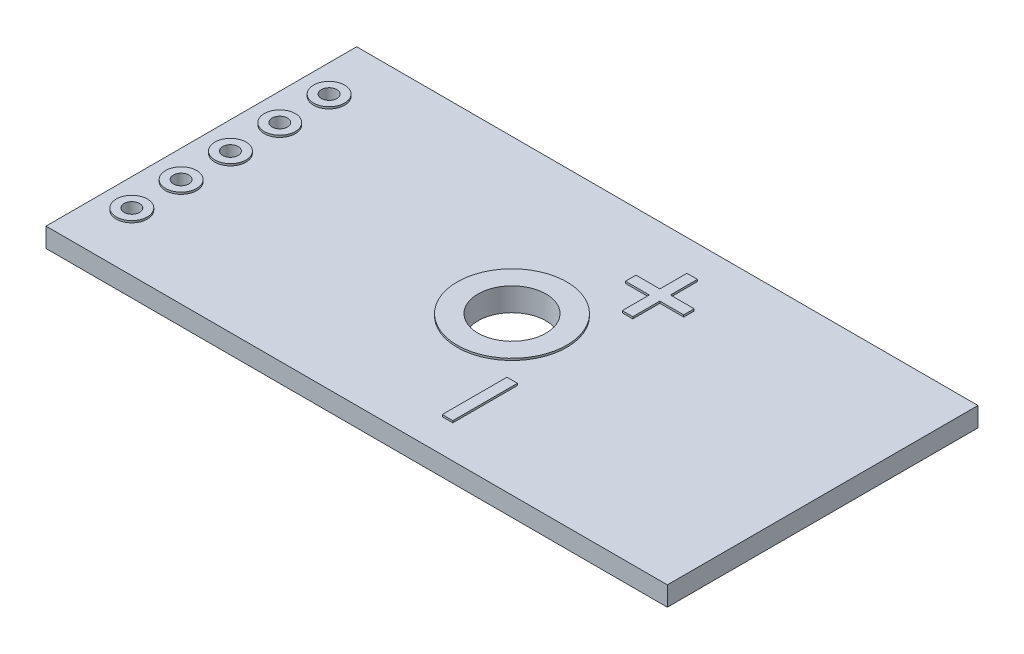
from build123d import *

# Parameters (mm, degrees)
SKETCH1_W                = 32
SKETCH1_H                = 16
BOSS_EXTRUDE1_DEPTH      = 1
SKETCH2_R                = 1.75
SKETCH2_R_2              = 0.4
CUT_EXTRUDE1_DEPTH       = 1
BOSS_EXTRUDE2_DEPTH      = 0.1
BOSS_EXTRUDE2_DEPTH_BACK = 1.1
SKETCH3_R                = 0.8
SKETCH3_R_2              = 0.4
SKETCH3_R_3              = 2.823446158
SKETCH3_R_4              = 1.75
SKETCH4_W                = 0.541769891
SKETCH4_H                = 3.328015046
BOSS_EXTRUDE3_DEPTH      = 0.1


with BuildPart() as part:
    # Sketch1 → Boss-Extrude1 (new body)
    with BuildSketch(Plane(origin=(0, 0, 0), x_dir=(1, 0, 0), z_dir=(0, 1, 0))):
        Rectangle(SKETCH1_W, SKETCH1_H)
    extrude(amount=BOSS_EXTRUDE1_DEPTH)

    # Sketch2 → Cut-Extrude1 (cut)
    with BuildSketch(Plane(origin=(0, 1, 0), x_dir=(1, 0, 0), z_dir=(0, 1, 0))):
        with Locations(Location((0, 0, 0), (0, 0, 270))):
            Circle(SKETCH2_R)
        with Locations(Location((-14.5, -5.08, 0), (0, 0, 270))):
            Circle(SKETCH2_R_2)
        with Locations(Location((-14.5, -2.54, 0), (0, 0, 270))):
            Circle(SKETCH2_R_2)
        with Locations(Location((-14.5, 0, 0), (0, 0, 270))):
            Circle(SKETCH2_R_2)
        with Locations(Location((-14.5, 2.54, 0), (0, 0, 270))):
            Circle(SKETCH2_R_2)
        with Locations(Location((-14.5, 5.08, 0), (0, 0, 270))):
            Circle(SKETCH2_R_2)
    extrude(amount=-CUT_EXTRUDE1_DEPTH, mode=Mode.SUBTRACT)

    # Sketch3 → Boss-Extrude2 (add, two sides: drawn at the far end of the back side and taken through both)
    # profile 1 of 6: a face of its own
    with BuildSketch(Plane(origin=(0, 1, 0), x_dir=(1, 0, 0), z_dir=(0, 1, 0)).offset(-BOSS_EXTRUDE2_DEPTH_BACK)):
        with Locations(Location((-14.5, 5.08, 0), (0, 0, 270))):
            Circle(SKETCH3_R)
        with Locations(Location((-14.5, 5.08, 0), (0, 0, 270))):
            Circle(SKETCH3_R_2, mode=Mode.SUBTRACT)
    # profile 2 of 6: a face of its own
    with BuildSketch(Plane(origin=(0, 1, 0), x_dir=(1, 0, 0), z_dir=(0, 1, 0)).offset(-BOSS_EXTRUDE2_DEPTH_BACK)):
        with Locations(Location((-14.5, 2.54, 0), (0, 0, 270))):
            Circle(SKETCH3_R)
        with Locations(Location((-14.5, 2.54, 0), (0, 0, 270))):
            Circle(SKETCH3_R_2, mode=Mode.SUBTRACT)
    # profile 3 of 6: a face of its own
    with BuildSketch(Plane(origin=(0, 1, 0), x_dir=(1, 0, 0), z_dir=(0, 1, 0)).offset(-BOSS_EXTRUDE2_DEPTH_BACK)):
        with Locations(Location((-14.5, 0, 0), (0, 0, 270))):
            Circle(SKETCH3_R)
        with Locations(Location((-14.5, 0, 0), (0, 0, 270))):
            Circle(SKETCH3_R_2, mode=Mode.SUBTRACT)
    # profile 4 of 6: a face of its own
    with BuildSketch(Plane(origin=(0, 1, 0), x_dir=(1, 0, 0), z_dir=(0, 1, 0)).offset(-BOSS_EXTRUDE2_DEPTH_BACK)):
        with Locations(Location((-14.5, -2.54, 0), (0, 0, 270))):
            Circle(SKETCH3_R)
        with Locations(Location((-14.5, -2.54, 0), (0, 0, 270))):
            Circle(SKETCH3_R_2, mode=Mode.SUBTRACT)
    # profile 5 of 6: a face of its own
    with BuildSketch(Plane(origin=(0, 1, 0), x_dir=(1, 0, 0), z_dir=(0, 1, 0)).offset(-BOSS_EXTRUDE2_DEPTH_BACK)):
        with Locations(Location((-14.5, -5.08, 0), (0, 0, 270))):
            Circle(SKETCH3_R)
        with Locations(Location((-14.5, -5.08, 0), (0, 0, 270))):
            Circle(SKETCH3_R_2, mode=Mode.SUBTRACT)
    # profile 6 of 6: a face of its own
    with BuildSketch(Plane(origin=(0, 1, 0), x_dir=(1, 0, 0), z_dir=(0, 1, 0)).offset(-BOSS_EXTRUDE2_DEPTH_BACK)):
        with Locations(Location((0, 0, 0), (0, 0, 270))):
            Circle(SKETCH3_R_3)
        with Locations(Location((0, 0, 0), (0, 0, 270))):
            Circle(SKETCH3_R_4, mode=Mode.SUBTRACT)
    extrude(amount=BOSS_EXTRUDE2_DEPTH + BOSS_EXTRUDE2_DEPTH_BACK)

    # Sketch4 → Boss-Extrude3 (add)
    with BuildSketch(Plane(origin=(0, 1, 0), x_dir=(1, 0, 0), z_dir=(0, 1, 0))):
        Polygon((3.250619348, 6.3), (3.250619348, 4.905884946), (4.479734402, 4.905884946), (4.479734402, 4.364115054), (3.250619348, 4.364115054), (3.250619348, 2.97), (2.708849457, 2.97), (2.708849457, 4.364115054), (1.479734402, 4.364115054), (1.479734402, 4.905884946), (2.708849457, 4.905884946), (2.708849457, 6.3), align=None)
        with Locations((2.979734403, -4.634884299)):
            Rectangle(SKETCH4_W, SKETCH4_H)
    extrude(amount=BOSS_EXTRUDE3_DEPTH)


solid = part.part
